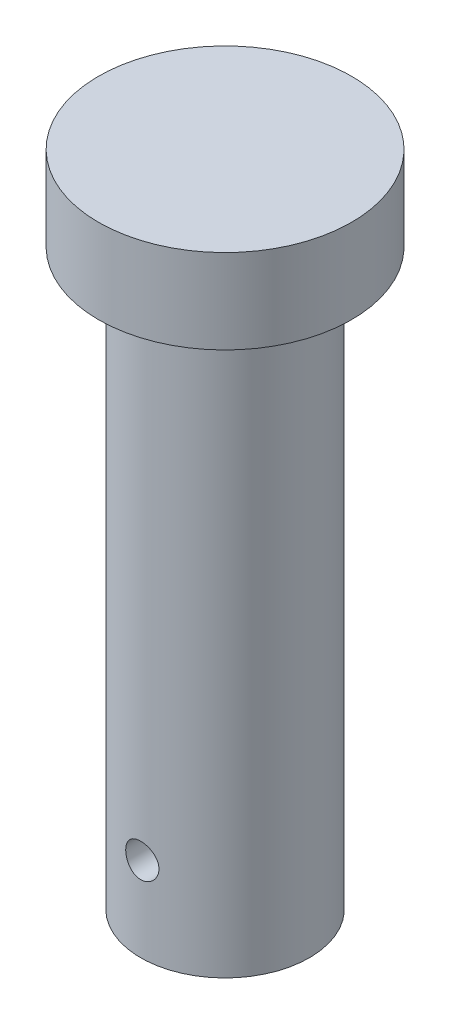
from build123d import *

# Parameters (mm, degrees)
CROQUIS1_R              = 22.5
SALIENTE_EXTRUIR1_DEPTH = 15
CROQUIS2_R              = 15
SALIENTE_EXTRUIR2_DEPTH = 102
CROQUIS4_R              = 2.957727645
CORTAR_EXTRUIR1_DEPTH   = 48.5


with BuildPart() as part:
    # Croquis1 → Saliente-Extruir1 (new body)
    with BuildSketch(Plane(origin=(0, 0, 0), x_dir=(1, 0, 0), z_dir=(0, 1, 0))):
        with Locations(Location((0, 0, 0), (0, 0, 270))):
            Circle(CROQUIS1_R)
    extrude(amount=-SALIENTE_EXTRUIR1_DEPTH)

    # Croquis2 → Saliente-Extruir2 (add)
    with BuildSketch(Plane.XZ.offset(15)):
        with Locations(Location((0, 0, 0), (0, 0, 270))):
            Circle(CROQUIS2_R)
    extrude(amount=SALIENTE_EXTRUIR2_DEPTH)

    # Croquis4 → Cortar-Extruir1 (cut, symmetric)
    with BuildSketch(Plane.XY):
        with Locations(Location((0, -102, 0), (0, 0, 269.999999959))):
            Circle(CROQUIS4_R)
    extrude(amount=CORTAR_EXTRUIR1_DEPTH, both=True, mode=Mode.SUBTRACT)


solid = part.part
